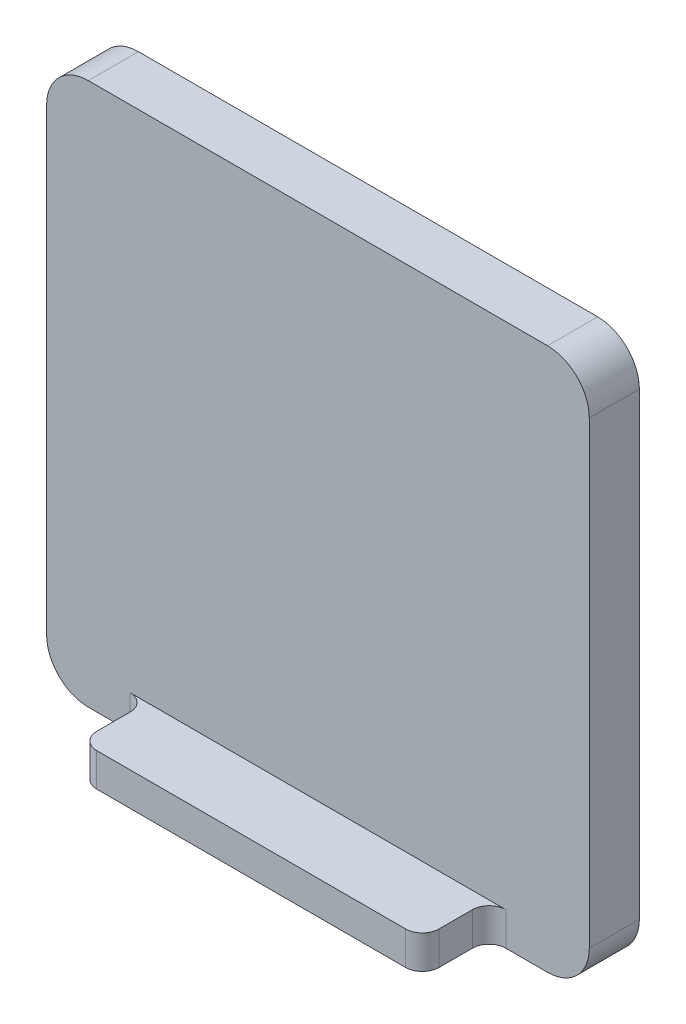
from build123d import *

# Parameters (mm, degrees)
SKETCH1_W           = 65
SKETCH1_H           = 65
BOSS_EXTRUDE1_DEPTH = 6
FILLET1_R           = 5
SKETCH2_W           = 41
SKETCH2_H           = 4
BOSS_EXTRUDE2_DEPTH = 8
FILLET2_R           = 2


with BuildPart() as part:
    # Sketch1 → Boss-Extrude1 (new body)
    with BuildSketch(Plane.XY):
        Rectangle(SKETCH1_W, SKETCH1_H)
    extrude(amount=BOSS_EXTRUDE1_DEPTH)

    # Fillet1
    fillet1_edges = [part.edges().sort_by_distance(p)[0] for p in [
        (32.5, -32.5, 3),
        (-32.5, -32.5, 3),
        (-32.5, 32.5, 3),
        (32.5, 32.5, 3),
    ]]
    fillet(fillet1_edges, radius=FILLET1_R)

    # Sketch2 → Boss-Extrude2 (add)
    with BuildSketch(Plane.XY.offset(6)):
        with Locations((0, -30.5)):
            Rectangle(SKETCH2_W, SKETCH2_H)
    extrude(amount=BOSS_EXTRUDE2_DEPTH)

    # Fillet2
    fillet2_edges = [part.edges().sort_by_distance(p)[0] for p in [
        (-20.5, -30.5, 6),
        (20.5, -30.5, 6),
        (-20.5, -30.5, 14),
        (20.5, -30.5, 14),
    ]]
    fillet(fillet2_edges, radius=FILLET2_R)


solid = part.part
